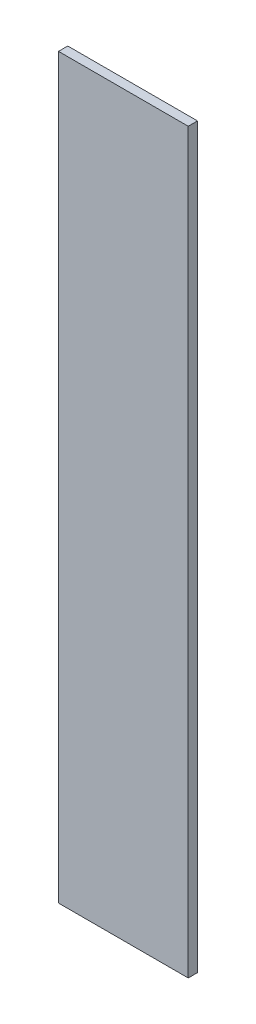
from build123d import *

# Parameters (mm, degrees)
SKETCH2_W           = 505.46
SKETCH2_H           = 88.9
BOSS_EXTRUDE1_DEPTH = 6.35


with BuildPart() as part:
    # Sketch2 → Boss-Extrude1 (new body)
    with BuildSketch(Plane(origin=(0, 0, 0), x_dir=(0, 1, 0), z_dir=(0, 0, 1))):
        with Locations((252.73, 44.45)):
            Rectangle(SKETCH2_W, SKETCH2_H)
    extrude(amount=BOSS_EXTRUDE1_DEPTH)


solid = part.part
